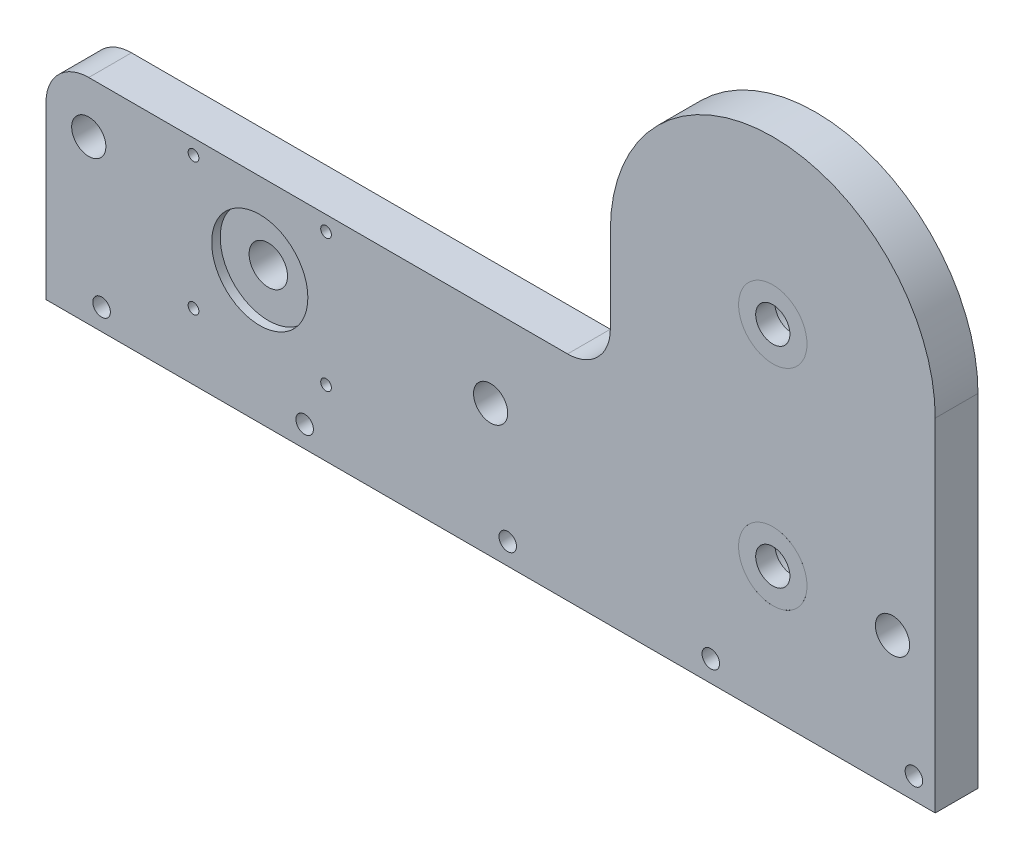
from build123d import *

# Parameters (mm, degrees)
CROQUIS1_R                = 8
CROQUIS1_R_2              = 4.5
CROQUIS1_R_3              = 1.25
SALIENTE_EXTRUIR1_DEPTH   = 10
CROQUIS2_R                = 11.25
CORTAR_EXTRUIR1_DEPTH     = 2
CROQUIS3_R                = 8
CORTAR_EXTRUIR2_DEPTH     = 10
CROQUIS4_R                = 2.05
CORTAR_EXTRUIR3_DEPTH     = 240.3491174
CROQUIS6_R                = 8
CROQUIS6_R_2              = 4
SALIENTE_EXTRUIR2_DEPTH   = 4.5
SALIENTE_EXTRUIR2_2_DEPTH = 4.5
CROQUIS7_R                = 4
CORTAR_EXTRUIR4_DEPTH     = 240.3491174


with BuildPart() as part:
    # Croquis1 → Saliente-Extruir1 (new body)
    with BuildSketch(Plane.XY):
        with BuildLine():
            Line((0, 0), (208, 0))
            Line((208, 0), (208, 80))
            ThreePointArc((208, 80), (170, 118), (132, 80))
            Line((132, 80), (132, 60))
            ThreePointArc((132, 60), (129.071067812, 52.928932188), (122, 50))
            Line((122, 50), (10, 50))
            ThreePointArc((10, 50), (2.928932188, 47.071067812), (0, 40))
            Line((0, 40), (0, 0))
        make_face()
        with Locations((170, 80)):
            Circle(CROQUIS1_R, mode=Mode.SUBTRACT)
        with Locations((50, 31)):
            Circle(CROQUIS1_R_2, mode=Mode.SUBTRACT)
        with Locations((65.5, 46.5)):
            Circle(CROQUIS1_R_3, mode=Mode.SUBTRACT)
        with Locations((34.5, 46.5)):
            Circle(CROQUIS1_R_3, mode=Mode.SUBTRACT)
        with Locations((34.5, 15.5)):
            Circle(CROQUIS1_R_3, mode=Mode.SUBTRACT)
        with Locations((65.5, 15.5)):
            Circle(CROQUIS1_R_3, mode=Mode.SUBTRACT)
    extrude(amount=-SALIENTE_EXTRUIR1_DEPTH)

    # Croquis2 → Cortar-Extruir1 (cut)
    with BuildSketch(Plane.XY):
        with Locations((50, 31)):
            Circle(CROQUIS2_R)
    extrude(amount=-CORTAR_EXTRUIR1_DEPTH, mode=Mode.SUBTRACT)

    # Croquis3 → Cortar-Extruir2 (cut)
    with BuildSketch(Plane(origin=(0, 0, -10), x_dir=(-1, 0, 0), z_dir=(0, 0, -1))):
        with Locations((-170, 31)):
            Circle(CROQUIS3_R)
    extrude(amount=-CORTAR_EXTRUIR2_DEPTH, mode=Mode.SUBTRACT)

    # Croquis4 → Cortar-Extruir3 (cut, through all)
    with BuildSketch(Plane(origin=(0, 0, -10), x_dir=(-1, 0, 0), z_dir=(0, 0, -1))):
        with Locations((-203, 5)):
            Circle(CROQUIS4_R)
        with Locations((-155.5, 5)):
            Circle(CROQUIS4_R)
        with Locations((-108, 5)):
            Circle(CROQUIS4_R)
        with Locations((-60.5, 5)):
            Circle(CROQUIS4_R)
        with Locations((-13, 5)):
            Circle(CROQUIS4_R)
    extrude(amount=-CORTAR_EXTRUIR3_DEPTH, mode=Mode.SUBTRACT)

    # Croquis7 → Cortar-Extruir4 (cut, through all)
    with BuildSketch(Plane(origin=(0, 0, -10), x_dir=(-1, 0, 0), z_dir=(0, 0, -1))):
        with Locations((-198, 31)):
            Circle(CROQUIS7_R)
        with Locations((-104, 31)):
            Circle(CROQUIS7_R)
        with Locations((-10, 38)):
            Circle(CROQUIS7_R)
    extrude(amount=-CORTAR_EXTRUIR4_DEPTH, mode=Mode.SUBTRACT)


with BuildPart() as body_2:
    # Croquis6 → Saliente-Extruir2 (new body)
    with BuildSketch(Plane.XY):
        with Locations((170, 31)):
            Circle(CROQUIS6_R)
        with Locations((170, 31)):
            Circle(CROQUIS6_R_2, mode=Mode.SUBTRACT)
    extrude(amount=-SALIENTE_EXTRUIR2_DEPTH)


with BuildPart() as body_3:
    # Croquis6 → Saliente-Extruir2 2 (new body)
    with BuildSketch(Plane.XY):
        with Locations((170, 80)):
            Circle(CROQUIS6_R)
        with Locations((170, 80)):
            Circle(CROQUIS6_R_2, mode=Mode.SUBTRACT)
    extrude(amount=-SALIENTE_EXTRUIR2_2_DEPTH)


solid = Compound([part.part, body_2.part, body_3.part])
